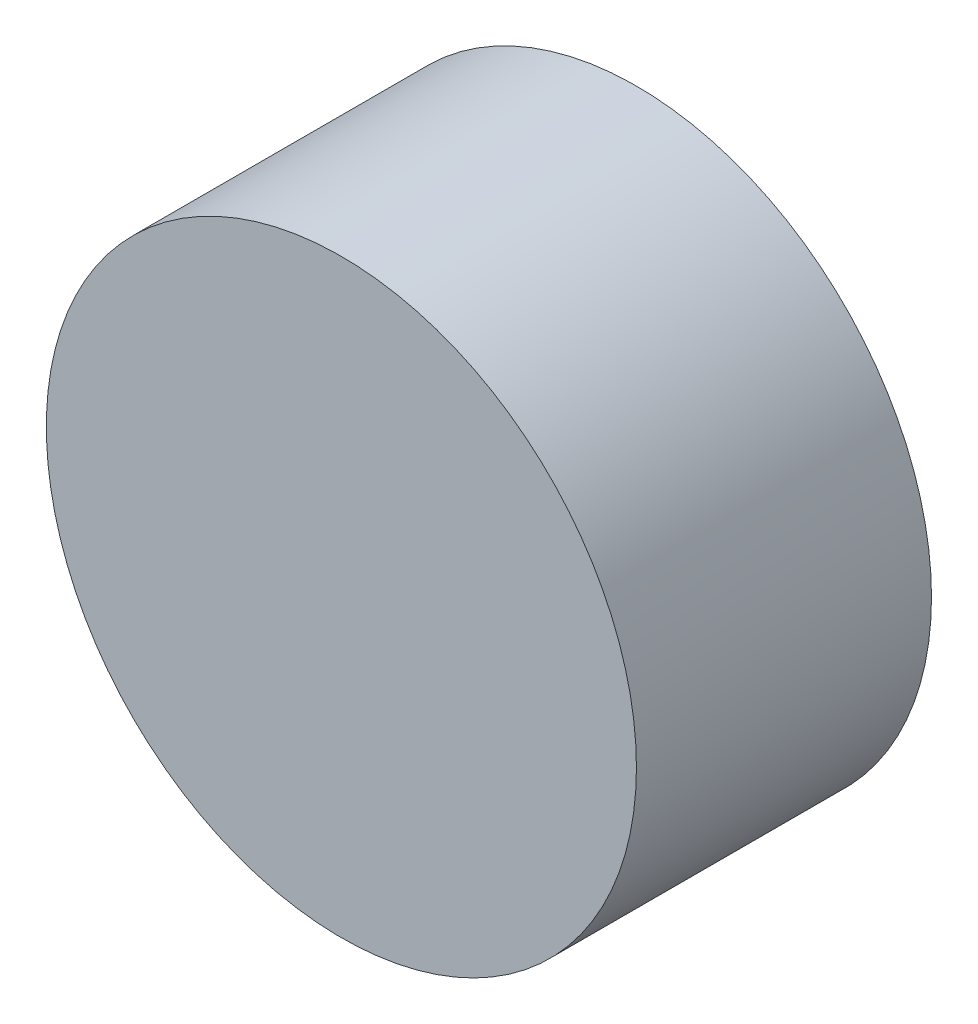
from build123d import *

# Parameters (mm, degrees)
SKETCH_1_R      = 10
EXTRUDE_1_DEPTH = 10


with BuildPart() as part:
    # 草图1 → 凸台-拉伸1 (new body)
    with BuildSketch(Plane.XY):
        Circle(SKETCH_1_R)
    extrude(amount=EXTRUDE_1_DEPTH)


solid = part.part
